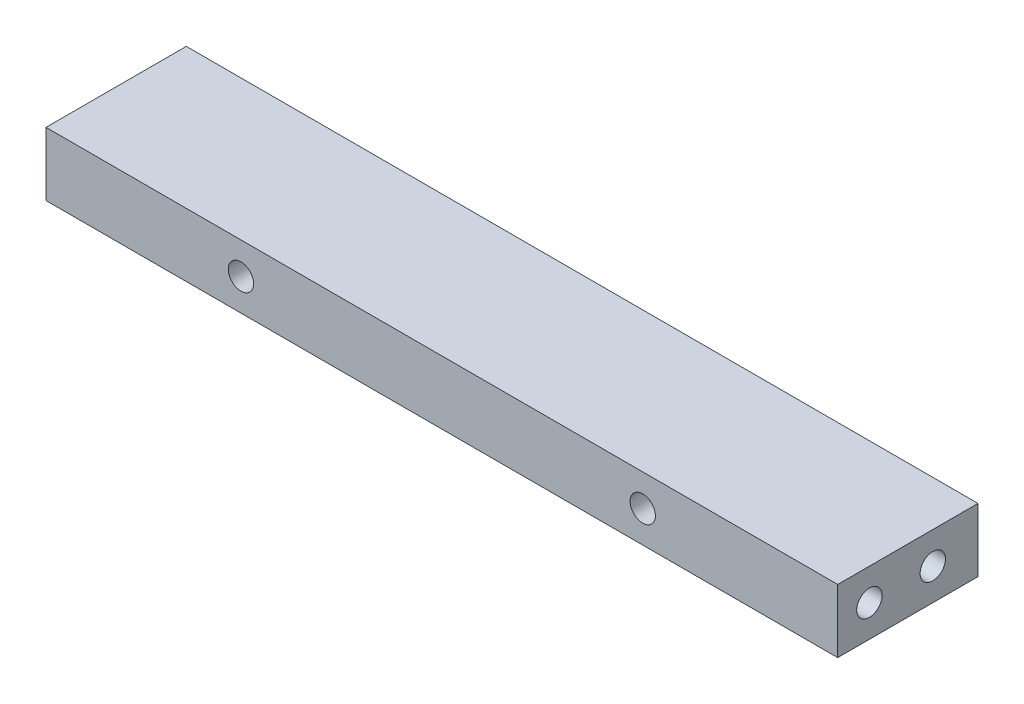
from build123d import *

# Parameters (mm, degrees)
MAIN_STOCK_START             = 2.248090434
SKETCH_1_W                   = 49.95
SKETCH_1_H                   = 4
MAIN_STOCK_DEPTH             = 8.851909566
SKETCH_2_R                   = 0.8
FRAME_2XD1P6_THROUGH_DEPTH   = 51.615894766
SKETCH_3_R                   = 0.8
CORNER_L_2XD1P6_BLIND5_DEPTH = 5
CORNER_R_2XD1P6_BLIND5_START = -5
SKETCH_4_R                   = 0.8
CORNER_R_2XD1P6_BLIND5_DEPTH = 5


with BuildPart() as part:
    # 草图1 → Main_Stock (new body)
    with BuildSketch(Plane.XY.offset(MAIN_STOCK_START)):
        with Locations((24.675, -2.3)):
            Rectangle(SKETCH_1_W, SKETCH_1_H)
    extrude(amount=MAIN_STOCK_DEPTH)

    # 草图2 → Frame_2xD1p6_Through (cut, through all)
    with BuildSketch(Plane.XY.offset(11.1)):
        with Locations((12, -2.3)):
            Circle(SKETCH_2_R)
        with Locations((37.35, -2.3)):
            Circle(SKETCH_2_R)
    extrude(amount=-FRAME_2XD1P6_THROUGH_DEPTH, mode=Mode.SUBTRACT)

    # 草图3 → Corner_L_2xD1p6_Blind5 (cut)
    with BuildSketch(Plane.ZY.offset(0.3)):
        with Locations((5.1, -2.3)):
            Circle(SKETCH_3_R)
        with Locations((9.1, -2.3)):
            Circle(SKETCH_3_R)
    extrude(amount=-CORNER_L_2XD1P6_BLIND5_DEPTH, mode=Mode.SUBTRACT)

    # 草图4 → Corner_R_2xD1p6_Blind5 (cut)
    with BuildSketch(Plane(origin=(49.65, 0, 0), x_dir=(0, 0, -1), z_dir=(1, 0, 0)).offset(CORNER_R_2XD1P6_BLIND5_START)):
        with Locations(Location((-5.1, -2.3, 0), (0, 0, 180))):
            Circle(SKETCH_4_R)
        with Locations(Location((-9.1, -2.3, 0), (0, 0, 180))):
            Circle(SKETCH_4_R)
    extrude(amount=CORNER_R_2XD1P6_BLIND5_DEPTH, mode=Mode.SUBTRACT)


solid = part.part
